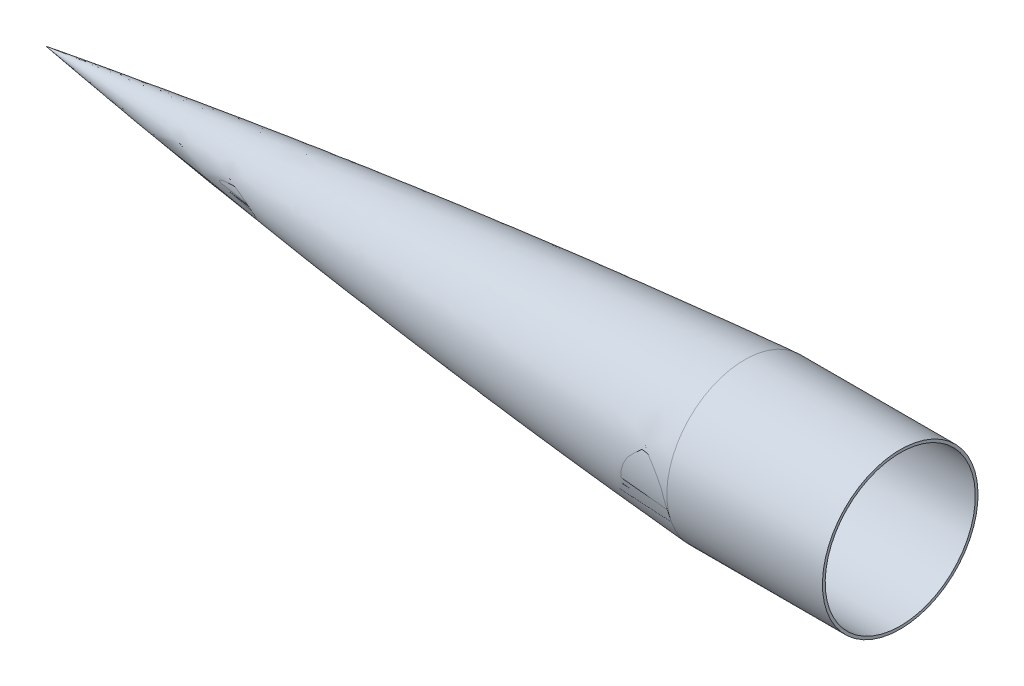
from build123d import *

# Parameters (mm, degrees)
REVOLVE2_ANGLE    = 5
CIRPATTERN2_COUNT = 10
SKETCH14_W        = 170
SKETCH14_H        = 3


with BuildPart() as part:
    # Sketch1 → Revolve1 (revolve)
    with BuildSketch(Plane(origin=(0, 0, 0), x_dir=(-1, 0, 0), z_dir=(0, 0, -1)), mode=Mode.PRIVATE) as revolve1_sk:
        with BuildLine():
            Line((-10.295326728, 0), (0, 0))
            ThreePointArc((0, 0), (-380.825050597, 49.616912867), (-763.235294117, 85))
            Line((-763.235294117, 85), (-763.382394472, 85))
            Line((-763.382394472, 85), (-763.382394472, 83.005416964))
            ThreePointArc((-763.382394472, 83.005416964), (-386.075108874, 48.43203393), (-10.295326728, 0))
        make_face()
    revolve(revolve1_sk.sketch.rotate(Axis((763.235294117, 0, 0), (-1, 0, 0)), 180), axis=Axis((763.235294117, 0, 0), (-1, 0, 0)))

    # Sketch3 → Revolve2 (revolve)
    with BuildSketch(Plane(origin=(0, 0, 0), x_dir=(-1, 0, 0), z_dir=(0, 0, -1))):
        with BuildLine():
            Line((-763.235294117, 85), (-763.235294117, 76.384660368))
            Line((-763.235294117, 76.384660368), (-755.235294117, 76.384660368))
            ThreePointArc((-755.235294117, 76.384660368), (-401.976683448, 45.269257315), (-50, 2))
            Line((-50, 2), (-50, 7.258))
            ThreePointArc((-50, 7.258), (-405.940423465, 52.342112203), (-763.235294117, 85))
        make_face()
    revolve2 = revolve(axis=Axis((763.235294117, 0, 0), (-1, 0, 0)), revolution_arc=REVOLVE2_ANGLE)

    # CirPattern2: Revolve2 ×10 about axis
    cirpattern2_axis = Axis((0, 0, 0), (1, 0, 0))
    for i in range(1, CIRPATTERN2_COUNT):
        add(revolve2.rotate(cirpattern2_axis, i * 360 / CIRPATTERN2_COUNT))

    # Sketch10 → Revolve3 (revolve)
    with BuildSketch(Plane(origin=(0, 0, 0), x_dir=(-1, 0, 0), z_dir=(0, 0, -1)), mode=Mode.PRIVATE) as revolve3_sk:
        Polygon((-50, 7.258), (-50, 0), (-48.275729811, 0), (-48.327021995, 6.918585273), align=None)
    revolve(revolve3_sk.sketch.rotate(Axis((763.235294117, 0, 0), (-1, 0, 0)), 180), axis=Axis((763.235294117, 0, 0), (-1, 0, 0)))

    # Sketch14 → Revolve4 (revolve)
    with BuildSketch(Plane(origin=(0, 0, 0), x_dir=(-1, 0, 0), z_dir=(0, 0, -1)), mode=Mode.PRIVATE) as revolve4_sk:
        with Locations((-848.235294117, 83.5)):
            Rectangle(SKETCH14_W, SKETCH14_H)
    revolve(revolve4_sk.sketch.rotate(Axis((763.235294117, 0, 0), (1, 0, 0)), 180), axis=Axis((763.235294117, 0, 0), (1, 0, 0)))


solid = part.part
